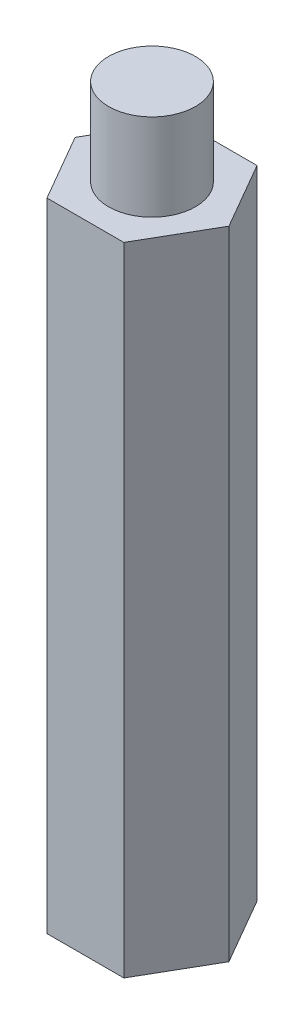
from build123d import *

# Parameters (mm, degrees)
EXTRUDE_1_DEPTH     = 22
SKETCH_2_R          = 1.5
EXTRUDE_2_DEPTH     = 3
SKETCH_3_R          = 1.5
CUT_EXTRUDE_1_DEPTH = 3


with BuildPart() as part:
    # 草图1 → 凸台-拉伸1 (new body)
    with BuildSketch(Plane(origin=(0, 0, 0), x_dir=(1, 0, 0), z_dir=(0, 1, 0))):
        Polygon((2.655811238, 0), (1.327905619, 2.3), (-1.327905619, 2.3), (-2.655811238, 0), (-1.327905619, -2.3), (1.327905619, -2.3), align=None)
    extrude(amount=EXTRUDE_1_DEPTH)

    # 草图2 → 凸台-拉伸2 (add)
    with BuildSketch(Plane(origin=(0, 22, 0), x_dir=(1, 0, 0), z_dir=(0, 1, 0))):
        with Locations(Location((0, 0, 0), (0, 0, 270))):
            Circle(SKETCH_2_R)
    extrude(amount=EXTRUDE_2_DEPTH)

    # 草图3 → 切除-拉伸1 (cut)
    with BuildSketch(Plane(origin=(0, 0, 0), x_dir=(-1, 0, 0), z_dir=(0, -1, 0))):
        with Locations(Location((0, 0, 0), (0, 0, 270))):
            Circle(SKETCH_3_R)
    extrude(amount=-CUT_EXTRUDE_1_DEPTH, mode=Mode.SUBTRACT)


solid = part.part
